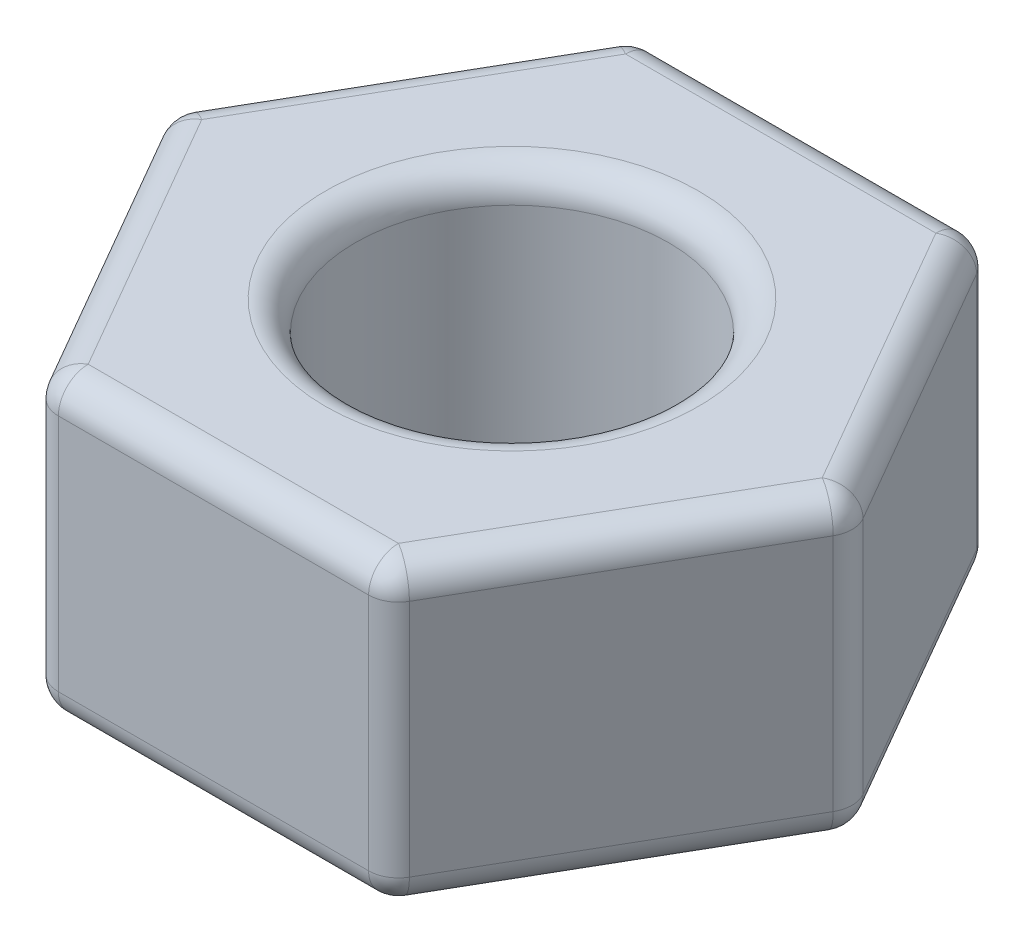
from build123d import *

# Parameters (mm, degrees)
MAIN_BLOCK_DEPTH    = 4
M5_TAPPED_SECTION_D = 4.2
COSMETIC_FILLETS_R  = 0.4


with BuildPart() as part:
    # Main Block Sketch → Main Block (new body)
    with BuildSketch(Plane(origin=(0, 0, 0), x_dir=(1, 0, 0), z_dir=(0, 1, 0))):
        Polygon((2.309401077, 4), (-2.309401077, 4), (-4.618802154, 0), (-2.309401077, -4), (2.309401077, -4), (4.618802154, 0), align=None)
    extrude(amount=MAIN_BLOCK_DEPTH)

    # M5 Tapped section (through all)
    with Locations(Plane(origin=(0, 0, 0), x_dir=(-1, 0, 0), z_dir=(0, -1, 0))):
        with Locations((0, 0)):
            Hole(M5_TAPPED_SECTION_D / 2)

    # Cosmetic Fillets
    cosmetic_fillets_edges = [part.edges().sort_by_distance(p)[0] for p in [
        (4.618802154, 2, 0),
        (2.309401077, 2, 4),
        (-2.309401077, 2, 4),
        (-4.618802154, 2, 0),
        (-2.309401077, 2, -4),
        (2.309401077, 2, -4),
        (-3.464101615, 4, -2),
        (-3.464101615, 4, 2),
        (0, 4, 4),
        (-2.1, 0, 0),
        (-2.1, 4, 0),
        (3.464101615, 4, 2),
        (3.464101615, 4, -2),
        (3.464101615, 0, 2),
        (0, 0, 4),
        (-3.464101615, 0, 2),
        (-3.464101615, 0, -2),
        (0, 0, -4),
        (3.464101615, 0, -2),
        (0, 4, -4),
    ]]
    fillet(cosmetic_fillets_edges, radius=COSMETIC_FILLETS_R)


solid = part.part
